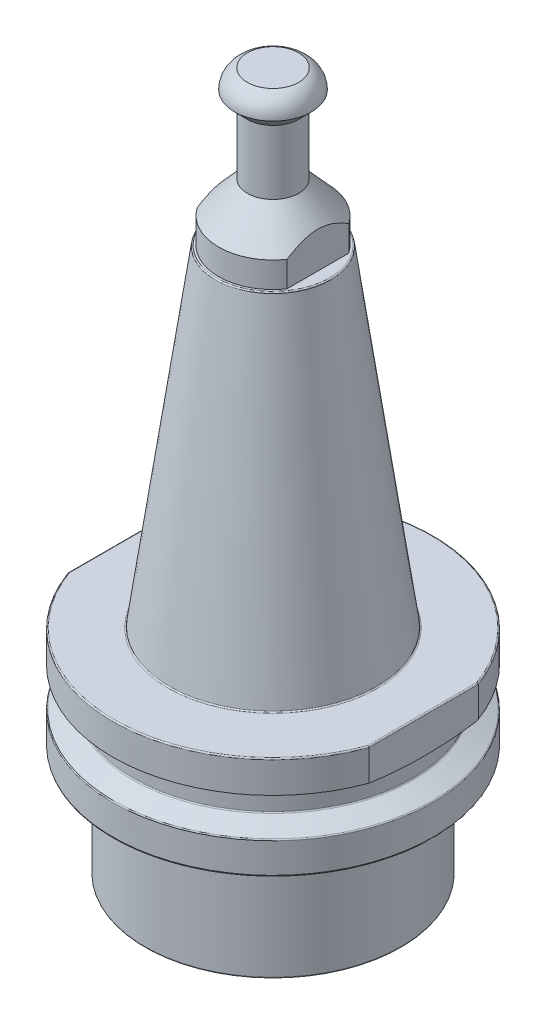
from build123d import *

# Parameters (mm, degrees)
SKETCH_2_W          = 22.739773216
SKETCH_2_H          = 47.155875868
SKETCH_2_W_2        = 18.439623794
SKETCH_2_H_2        = 50.144115297
CUT_EXTRUDE_1_DEPTH = 10
SKETCH_3_W          = 5.385282973
SKETCH_3_H          = 13.963609834
SKETCH_3_W_2        = 7.005633603
SKETCH_3_H_2        = 16.441793149
CUT_EXTRUDE_2_DEPTH = 11
FILLET_1_R          = 0.2


with BuildPart() as part:
    # Эскиз1 → Повернуть1 (revolve)
    with BuildSketch(Plane.XY, mode=Mode.PRIVATE) as revolve_1_sk:
        with BuildLine():
            Line((0, 32.5), (11, 32.5))
            Line((11, 32.5), (16.25, 0))
            Line((16.25, 0), (20, 0))
            Line((20, 0), (20, 17.3))
            Line((20, 17.3), (25, 17.3))
            Line((25, 17.3), (25, 22.3))
            Line((25, 22.3), (21.75, 23.7))
            Line((21.75, 23.7), (21.75, 26.9))
            Line((21.75, 26.9), (25, 28.3))
            Line((25, 28.3), (25, 33.3))
            Line((25, 33.3), (16.2, 33.3))
            Line((16.2, 33.3), (9, 85))
            Line((9, 85), (8.5, 85))
            Line((8.5, 85), (8.5, 89))
            Line((8.5, 89), (4, 94))
            Line((4, 94), (4, 104))
            Line((4, 104), (6, 106))
            ThreePointArc((6, 106), (5.458973143, 107.805982095), (4, 109))
            Line((4, 109), (0, 109))
            Line((0, 109), (0, 32.5))
        make_face()
    revolve(revolve_1_sk.sketch.rotate(Axis((0, 0, 0), (0, 1, 0)), 90), axis=Axis((0, 0, 0), (0, 1, 0)))

    # Эскиз2 → Вырез-Вытянуть1 (cut)
    with BuildSketch(Plane(origin=(0, 33.3, 0), x_dir=(1, 0, 0), z_dir=(0, 1, 0))):
        with Locations((-34.869886608, 4.83232903)):
            Rectangle(SKETCH_2_W, SKETCH_2_H)
        with Locations((32.719811897, 2.755138207)):
            Rectangle(SKETCH_2_W_2, SKETCH_2_H_2)
    extrude(amount=-CUT_EXTRUDE_1_DEPTH, mode=Mode.SUBTRACT)

    # Эскиз3 → Вырез-Вытянуть2 (cut)
    with BuildSketch(Plane(origin=(0, 85, 0), x_dir=(1, 0, 0), z_dir=(0, 1, 0))):
        with Locations((-9.692641487, -0.772936865)):
            Rectangle(SKETCH_3_W, SKETCH_3_H)
        with Locations((10.502816801, -0.653793436)):
            Rectangle(SKETCH_3_W_2, SKETCH_3_H_2)
    extrude(amount=CUT_EXTRUDE_2_DEPTH, mode=Mode.SUBTRACT)

    # Скругление1
    fillet_1_edges = [part.edges().sort_by_distance(p)[0] for p in [
        (0, 23.7, 21.75),
        (0, 26.9, 21.75),
        (0, 33.3, 16.2),
        (0, 33.3, -25),
        (0, 33.3, 25),
        (-23.5, 33.3, 0),
        (23.5, 33.3, 0),
        (0, 0, 16.25),
        (0, 0, 20),
        (0, 22.3, 25),
        (-14.348623168, 28.3, -20.472347525),
        (0, 17.3, 25),
        (0, 85, 9),
    ]]
    fillet(fillet_1_edges, radius=FILLET_1_R)


solid = part.part
